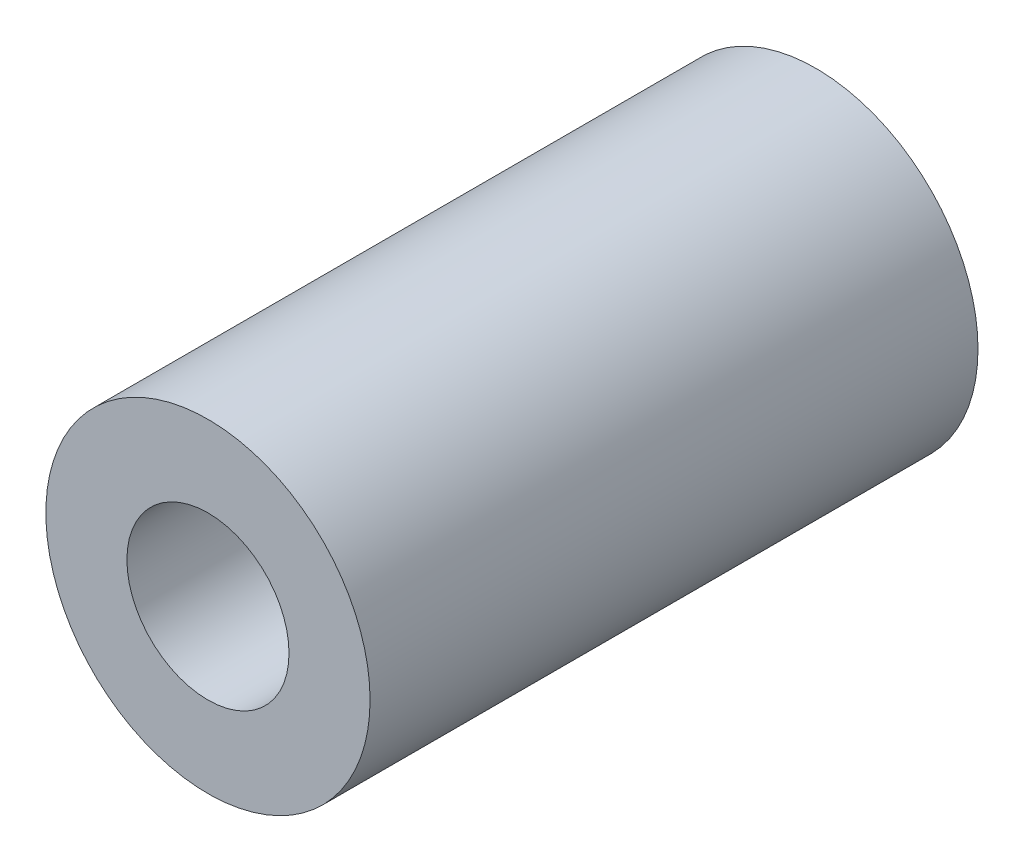
from build123d import *

# Parameters (mm, degrees)
SKETCH1_R           = 8
SKETCH1_R_2         = 2.5
BOSS_EXTRUDE1_DEPTH = 15
BOSS_EXTRUDE2_START = 15
SKETCH3_R           = 8
SKETCH3_R_2         = 4
BOSS_EXTRUDE2_DEPTH = 15


with BuildPart() as part:
    # Sketch1 → Boss-Extrude1 (new body)
    with BuildSketch(Plane.XY):
        Circle(SKETCH1_R)
        Circle(SKETCH1_R_2, mode=Mode.SUBTRACT)
    extrude(amount=-BOSS_EXTRUDE1_DEPTH)

    # Sketch3 → Boss-Extrude2 (add)
    with BuildSketch(Plane.XY.offset(BOSS_EXTRUDE2_START)):
        Circle(SKETCH3_R)
        Circle(SKETCH3_R_2, mode=Mode.SUBTRACT)
    extrude(amount=-BOSS_EXTRUDE2_DEPTH)


solid = part.part
